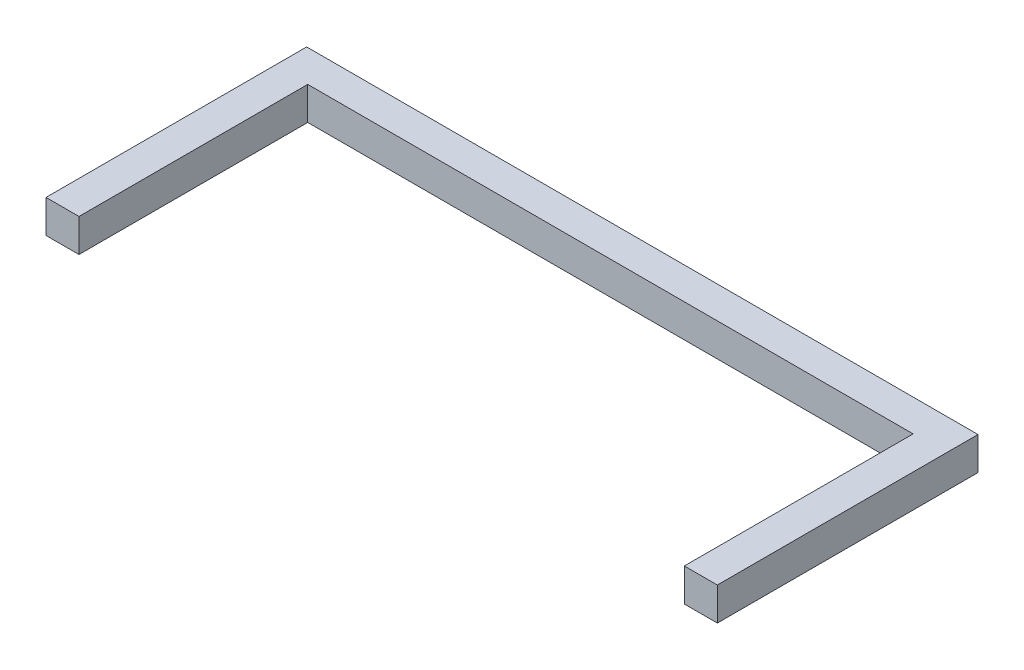
from build123d import *

# Parameters (mm, degrees)
BOSS_EXTRUDE1_DEPTH = 3.1


with BuildPart() as part:
    # Sketch1 → Boss-Extrude1 (new body)
    with BuildSketch(Plane(origin=(0, 0, 0), x_dir=(1, 0, 0), z_dir=(0, 1, 0))):
        Polygon((0, 0), (0, 24.5), (63.1, 24.5), (63.1, 0), (60, 0), (60, 21.5), (3.1, 21.5), (3.1, 0), align=None)
    extrude(amount=BOSS_EXTRUDE1_DEPTH)


solid = part.part
